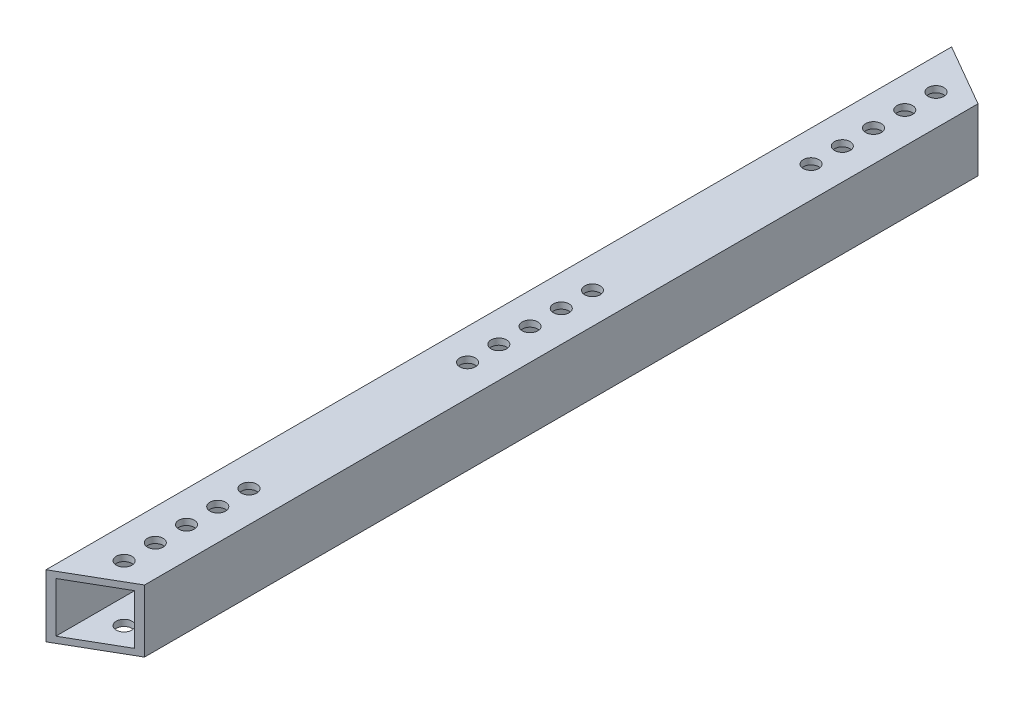
from build123d import *

# Parameters (mm, degrees)
SKETCH1_W           = 25.4
SKETCH1_H           = 25.4
SKETCH1_W_2         = 20.32
SKETCH1_H_2         = 20.32
BOSS_EXTRUDE2_DEPTH = 368.3
CUT_EXTRUDE1_DEPTH  = 370.393205135
SKETCH3_R           = 3.175
CUT_EXTRUDE2_DEPTH  = 370.393205135


with BuildPart() as part:
    # Sketch1 → Boss-Extrude2 (new body)
    with BuildSketch(Plane.XY):
        Rectangle(SKETCH1_W, SKETCH1_H)
        Rectangle(SKETCH1_W_2, SKETCH1_H_2, mode=Mode.SUBTRACT)
    extrude(amount=BOSS_EXTRUDE2_DEPTH)

    # Sketch2 → Cut-Extrude1 (cut, through all)
    with BuildSketch(Plane(origin=(0, 12.7, 0), x_dir=(1, 0, 0), z_dir=(0, 1, 0))):
        Polygon((-12.7, -368.3), (12.7, -353.635303163), (12.7, -368.3), align=None)
        Polygon((12.7, 0), (-12.7, 0), (12.7, -14.664696837), align=None)
    extrude(amount=-CUT_EXTRUDE1_DEPTH, mode=Mode.SUBTRACT)

    # Sketch3 → Cut-Extrude2 (cut, through all)
    with BuildSketch(Plane(origin=(0, 12.7, 0), x_dir=(1, 0, 0), z_dir=(0, 1, 0))):
        with Locations(Location((0, -184.15, 0), (0, 0, 270))):
            Circle(SKETCH3_R)
        with Locations(Location((0, -171.45, 0), (0, 0, 270))):
            Circle(SKETCH3_R)
        with Locations(Location((0, -158.75, 0), (0, 0, 270))):
            Circle(SKETCH3_R)
        with Locations((0, -209.55)):
            Circle(SKETCH3_R)
        with Locations((0, -196.85)):
            Circle(SKETCH3_R)
        with Locations(Location((0, -349.25, 0), (0, 0, 270))):
            Circle(SKETCH3_R)
        with Locations(Location((0, -336.55, 0), (0, 0, 270))):
            Circle(SKETCH3_R)
        with Locations(Location((0, -323.85, 0), (0, 0, 270))):
            Circle(SKETCH3_R)
        with Locations(Location((0, -311.15, 0), (0, 0, 270))):
            Circle(SKETCH3_R)
        with Locations(Location((0, -298.45, 0), (0, 0, 270))):
            Circle(SKETCH3_R)
        with Locations((0, -69.85)):
            Circle(SKETCH3_R)
        with Locations((0, -57.15)):
            Circle(SKETCH3_R)
        with Locations((0, -44.45)):
            Circle(SKETCH3_R)
        with Locations((0, -31.75)):
            Circle(SKETCH3_R)
        with Locations((0, -19.05)):
            Circle(SKETCH3_R)
    extrude(amount=-CUT_EXTRUDE2_DEPTH, mode=Mode.SUBTRACT)


solid = part.part
